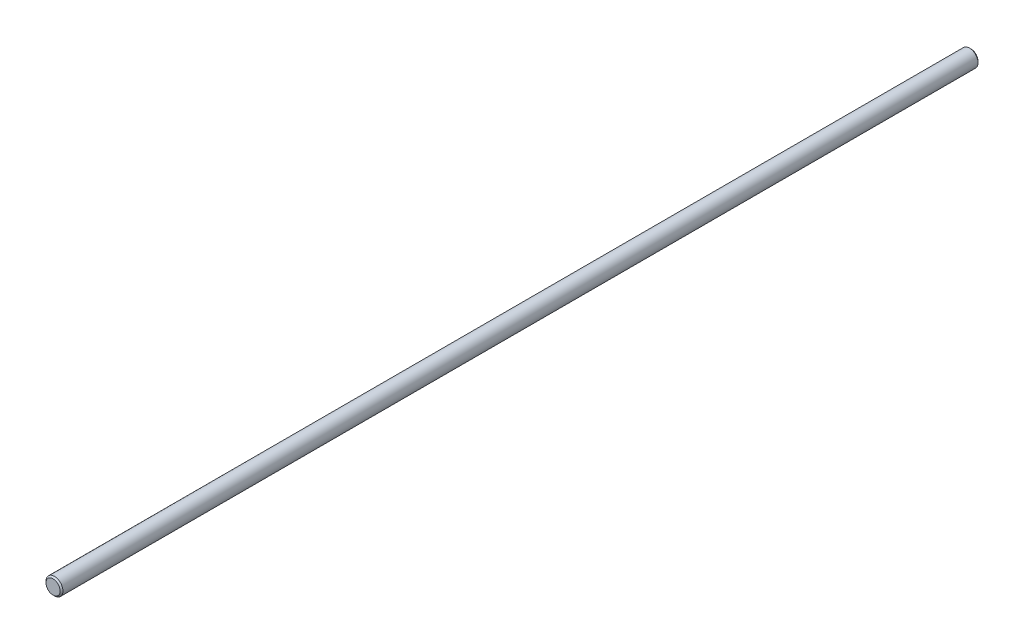
from build123d import *

# Parameters (mm, degrees)
SKETCH1_R           = 6
BOSS_EXTRUDE1_DEPTH = 325
CHAMFER1_SIZE       = 1


with BuildPart() as part:
    # Sketch1 → Boss-Extrude1 (new, symmetric)
    with BuildSketch(Plane.XY):
        Circle(SKETCH1_R)
    extrude(amount=BOSS_EXTRUDE1_DEPTH, both=True)

    # Chamfer1
    chamfer1_edges = [part.edges().sort_by_distance(p)[0] for p in [
        (-6, 0, -325),
        (-6, 0, 325),
    ]]
    chamfer(chamfer1_edges, length=CHAMFER1_SIZE)


solid = part.part
